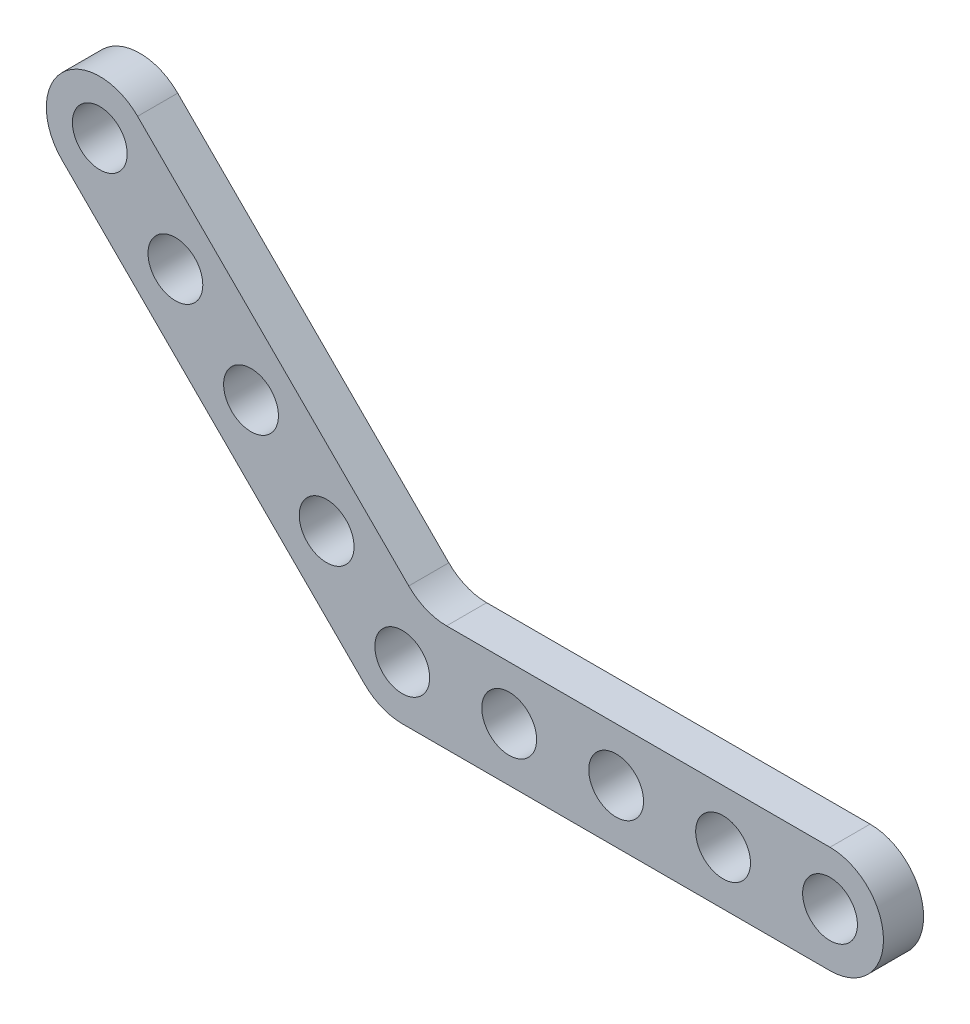
from build123d import *

# Parameters (mm, degrees)
BOSS_EXTRUDE1_DEPTH = 3
SKETCH2_R           = 2.05
CUT_EXTRUDE1_DEPTH  = 45.877826774
LPATTERN1_COUNT     = 5
LPATTERN1_PITCH     = 8
SKETCH3_R           = 2.05
CUT_EXTRUDE2_DEPTH  = 45.877826774
LPATTERN2_COUNT     = 5
LPATTERN2_PITCH     = 8


with BuildPart() as part:
    # Sketch1 → Boss-Extrude1 (new body)
    with BuildSketch(Plane.XY):
        with BuildLine():
            Line((3.313708499, 4), (32, 4))
            ThreePointArc((32, 4), (36, 0), (32, -4))
            Line((32, -4), (0, -4))
            ThreePointArc((0, -4), (-1.530733729, -3.69551813), (-2.828427125, -2.828427125))
            Line((-2.828427125, -2.828427125), (-25.455844123, 19.798989873))
            ThreePointArc((-25.455844123, 19.798989873), (-25.455844123, 25.455844123), (-19.798989873, 25.455844123))
            Line((-19.798989873, 25.455844123), (0.485281374, 5.171572875))
            ThreePointArc((0.485281374, 5.171572875), (1.78297477, 4.30448187), (3.313708499, 4))
        make_face()
    extrude(amount=BOSS_EXTRUDE1_DEPTH)

    # Sketch2 → Cut-Extrude1 (cut, through all)
    with BuildSketch(Plane.XY.offset(3)):
        with Locations((-22.627416998, 22.627416998)):
            Circle(SKETCH2_R)
    cut_extrude1 = extrude(amount=-CUT_EXTRUDE1_DEPTH, mode=Mode.SUBTRACT)

    # LPattern1: Cut-Extrude1 ×5
    with Locations(*[Vector(0.7071067811865515, -0.7071067811865437, 0) * (i * LPATTERN1_PITCH) for i in range(1, LPATTERN1_COUNT)]):
        add(cut_extrude1, mode=Mode.SUBTRACT)

    # Sketch3 → Cut-Extrude2 (cut, through all)
    with BuildSketch(Plane.XY.offset(3)):
        with Locations((32, 0)):
            Circle(SKETCH3_R)
    cut_extrude2 = extrude(amount=-CUT_EXTRUDE2_DEPTH, mode=Mode.SUBTRACT)

    # LPattern2: Cut-Extrude2 ×5
    with Locations(*[(-i * LPATTERN2_PITCH, 0, 0) for i in range(1, LPATTERN2_COUNT)]):
        add(cut_extrude2, mode=Mode.SUBTRACT)


solid = part.part
